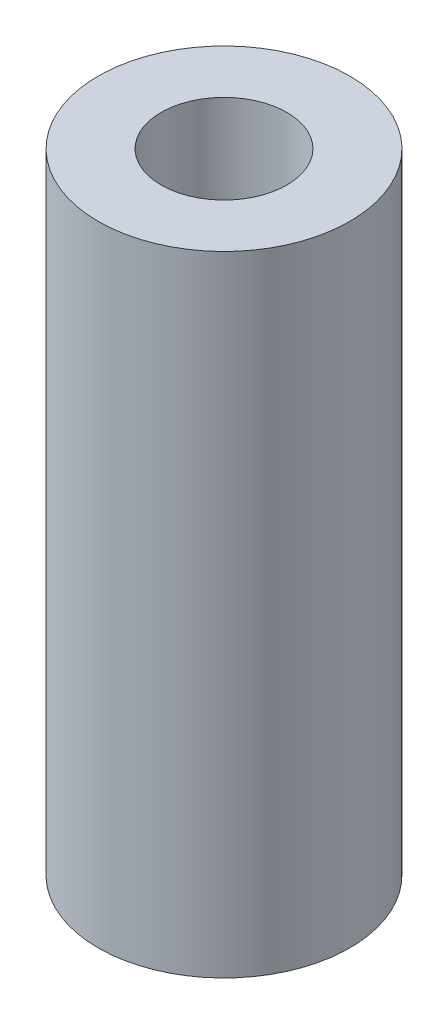
from build123d import *

# Parameters (mm, degrees)
SKETCH1_R           = 50.8
SKETCH1_R_2         = 25.4
BOSS_EXTRUDE1_DEPTH = 254


with BuildPart() as part:
    # Sketch1 → Boss-Extrude1 (new body)
    with BuildSketch(Plane(origin=(0, 0, 0), x_dir=(1, 0, 0), z_dir=(0, 1, 0))):
        with Locations(Location((0, 0, 0), (0, 0, 270))):
            Circle(SKETCH1_R)
        with Locations(Location((0, 0, 0), (0, 0, 270))):
            Circle(SKETCH1_R_2, mode=Mode.SUBTRACT)
    extrude(amount=BOSS_EXTRUDE1_DEPTH)


solid = part.part
